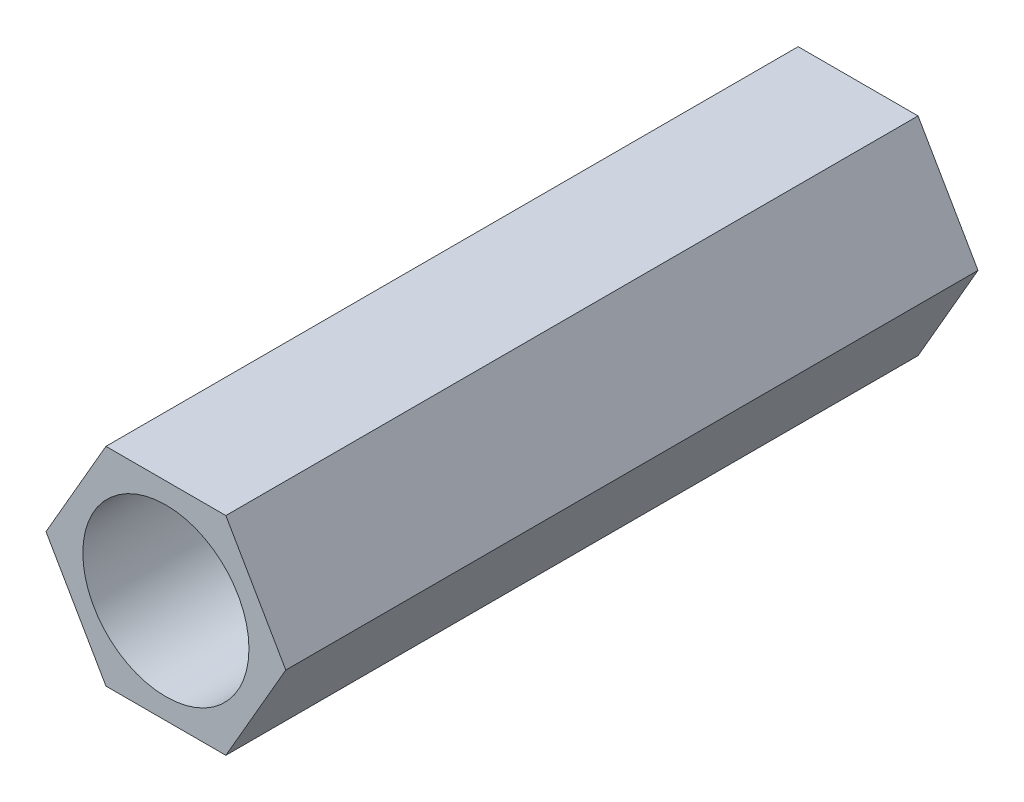
from build123d import *

# Parameters (mm, degrees)
EXTRUDE_1_DEPTH    = 10
HOLE_WIZARD_M2_1_D = 2.4


with BuildPart() as part:
    # 스케치1 → 보스-돌출1 (new body)
    with BuildSketch(Plane.XY):
        Polygon((0.866025404, -1.5), (1.732050808, 0), (0.866025404, 1.5), (-0.866025404, 1.5), (-1.732050808, 0), (-0.866025404, -1.5), align=None)
    extrude(amount=EXTRUDE_1_DEPTH)

    # M2 여유 구멍1 (through all)
    with Locations(Plane(origin=(0, 0, 0), x_dir=(-1, 0, 0), z_dir=(0, 0, -1))):
        with Locations((0, 0)):
            Hole(HOLE_WIZARD_M2_1_D / 2)


solid = part.part
